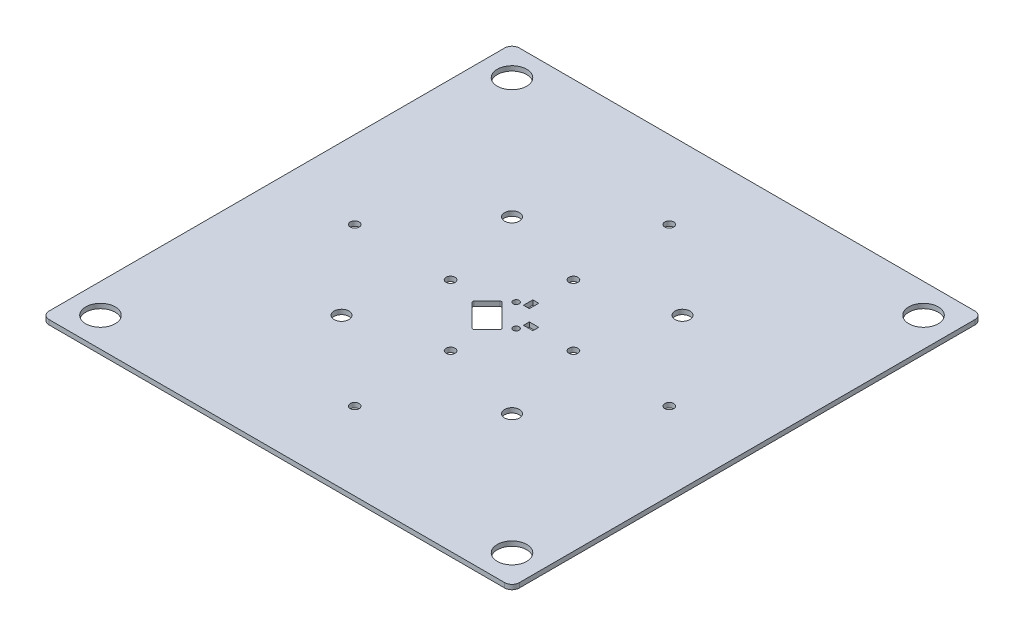
from build123d import *

# Parameters (mm, degrees)
SKETCH1_R           = 5
SKETCH1_R_2         = 1.525
SKETCH1_R_3         = 2.525
SKETCH1_R_4         = 1.025
BOSS_EXTRUDE1_DEPTH = 1.6


with BuildPart() as part:
    # Sketch1 → Boss-Extrude1 (new body)
    with BuildSketch(Plane(origin=(0, 0, 0), x_dir=(1, 0, 0), z_dir=(0, 1, 0))):
        with BuildLine():
            Line((557.234258902, 42.261494271), (402.234258902, 42.261494271))
            ThreePointArc((402.234258902, 42.261494271), (400.466491949, 41.529261224), (399.734258902, 39.761494271))
            Line((399.734258902, 39.761494271), (399.734258902, -115.238505729))
            ThreePointArc((399.734258902, -115.238505729), (400.466491949, -117.006272682), (402.234258902, -117.738505729))
            Line((402.234258902, -117.738505729), (557.234258902, -117.738505729))
            ThreePointArc((557.234258902, -117.738505729), (559.002025855, -117.006272682), (559.734258902, -115.238505729))
            Line((559.734258902, -115.238505729), (559.734258902, 39.761494271))
            ThreePointArc((559.734258902, 39.761494271), (559.002025855, 41.529261224), (557.234258902, 42.261494271))
        make_face()
        with Locations(Location((409.734258902, -107.738505729, 0), (0, 0, 270))):
            Circle(SKETCH1_R, mode=Mode.SUBTRACT)
        with Locations(Location((479.734258902, -91.238505729, 0), (0, 0, 270))):
            Circle(SKETCH1_R_2, mode=Mode.SUBTRACT)
        with Locations(Location((450.742880873, -66.729883758, 0), (0, 0, 270))):
            Circle(SKETCH1_R_3, mode=Mode.SUBTRACT)
        with Locations(Location((479.734258902, -58.638505729, 0), (0, 0, 270))):
            Circle(SKETCH1_R_2, mode=Mode.SUBTRACT)
        with BuildLine():
            Line((474.218826009, -35.617185386), (481.855579245, -43.253938622))
            ThreePointArc((481.855579245, -43.253938622), (482.002025855, -43.607492013), (481.855579245, -43.961045404))
            Line((481.855579245, -43.961045404), (477.471517202, -48.345107447))
            ThreePointArc((477.471517202, -48.345107447), (477.117963811, -48.491554056), (476.764410421, -48.345107447))
            Line((476.764410421, -48.345107447), (469.127657184, -40.70835421))
            ThreePointArc((469.127657184, -40.70835421), (468.981210575, -40.35480082), (469.127657184, -40.001247429))
            Line((469.127657184, -40.001247429), (473.511719227, -35.617185386))
            ThreePointArc((473.511719227, -35.617185386), (473.865272618, -35.470738776), (474.218826009, -35.617185386))
        make_face(mode=Mode.SUBTRACT)
        with Locations(Location((549.734258902, -107.738505729, 0), (0, 0, 270))):
            Circle(SKETCH1_R, mode=Mode.SUBTRACT)
        with Locations(Location((508.725636931, -66.729883758, 0), (0, 0, 270))):
            Circle(SKETCH1_R_3, mode=Mode.SUBTRACT)
        with Locations(Location((484.33045298, -40.920486245, 0), (0, 0, 270))):
            Circle(SKETCH1_R_4, mode=Mode.SUBTRACT)
        with Locations(Location((426.234258902, -37.738505729, 0), (0, 0, 270))):
            Circle(SKETCH1_R_2, mode=Mode.SUBTRACT)
        with Locations(Location((458.834258902, -37.738505729, 0), (0, 0, 270))):
            Circle(SKETCH1_R_2, mode=Mode.SUBTRACT)
        with Locations(Location((476.552278387, -33.142311651, 0), (0, 0, 270))):
            Circle(SKETCH1_R_4, mode=Mode.SUBTRACT)
        Polygon((480.734258902, -32.838505729), (479.734258902, -32.838505729), (478.734258902, -32.838505729), (478.734258902, -29.638505729), (480.734258902, -29.638505729), align=None, mode=Mode.SUBTRACT)
        with Locations(Location((450.742880873, -8.747127701, 0), (0, 0, 270))):
            Circle(SKETCH1_R_3, mode=Mode.SUBTRACT)
        with Locations(Location((479.734258902, -16.838505729, 0), (0, 0, 270))):
            Circle(SKETCH1_R_2, mode=Mode.SUBTRACT)
        with Locations(Location((409.734258902, 32.261494271, 0), (0, 0, 270))):
            Circle(SKETCH1_R, mode=Mode.SUBTRACT)
        with Locations(Location((479.734258902, 15.761494271, 0), (0, 0, 270))):
            Circle(SKETCH1_R_2, mode=Mode.SUBTRACT)
        Polygon((484.634258902, -38.738505729), (484.634258902, -37.738505729), (484.634258902, -36.738505729), (487.834258902, -36.738505729), (487.834258902, -38.738505729), align=None, mode=Mode.SUBTRACT)
        with Locations(Location((500.634258902, -37.738505729, 0), (0, 0, 270))):
            Circle(SKETCH1_R_2, mode=Mode.SUBTRACT)
        with Locations(Location((508.725636931, -8.747127701, 0), (0, 0, 270))):
            Circle(SKETCH1_R_3, mode=Mode.SUBTRACT)
        with Locations(Location((533.234258902, -37.738505729, 0), (0, 0, 270))):
            Circle(SKETCH1_R_2, mode=Mode.SUBTRACT)
        with Locations(Location((549.734258902, 32.261494271, 0), (0, 0, 270))):
            Circle(SKETCH1_R, mode=Mode.SUBTRACT)
    extrude(amount=BOSS_EXTRUDE1_DEPTH)


solid = part.part
